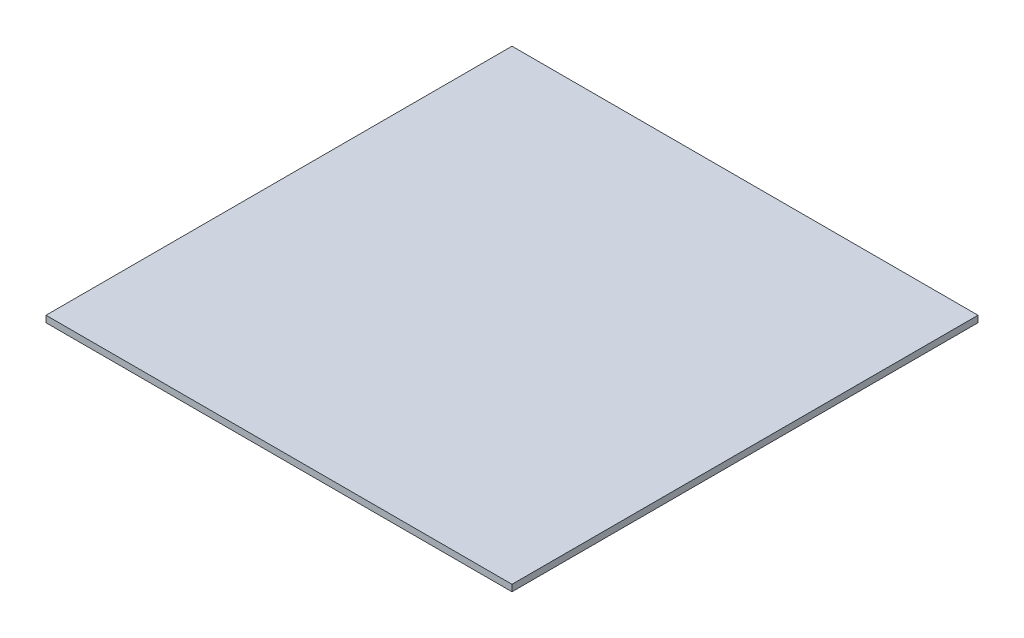
from build123d import *

# Parameters (mm, degrees)
ESBO_O1_W                = 214
ESBO_O1_H                = 214
RESSALTO_EXTRUS_O1_DEPTH = 3


with BuildPart() as part:
    # Esboço1 → Ressalto-extrusão1 (new body)
    with BuildSketch(Plane(origin=(0, 0, 0), x_dir=(1, 0, 0), z_dir=(0, 1, 0))):
        with Locations((107, 107)):
            Rectangle(ESBO_O1_W, ESBO_O1_H)
    extrude(amount=RESSALTO_EXTRUS_O1_DEPTH)


solid = part.part
